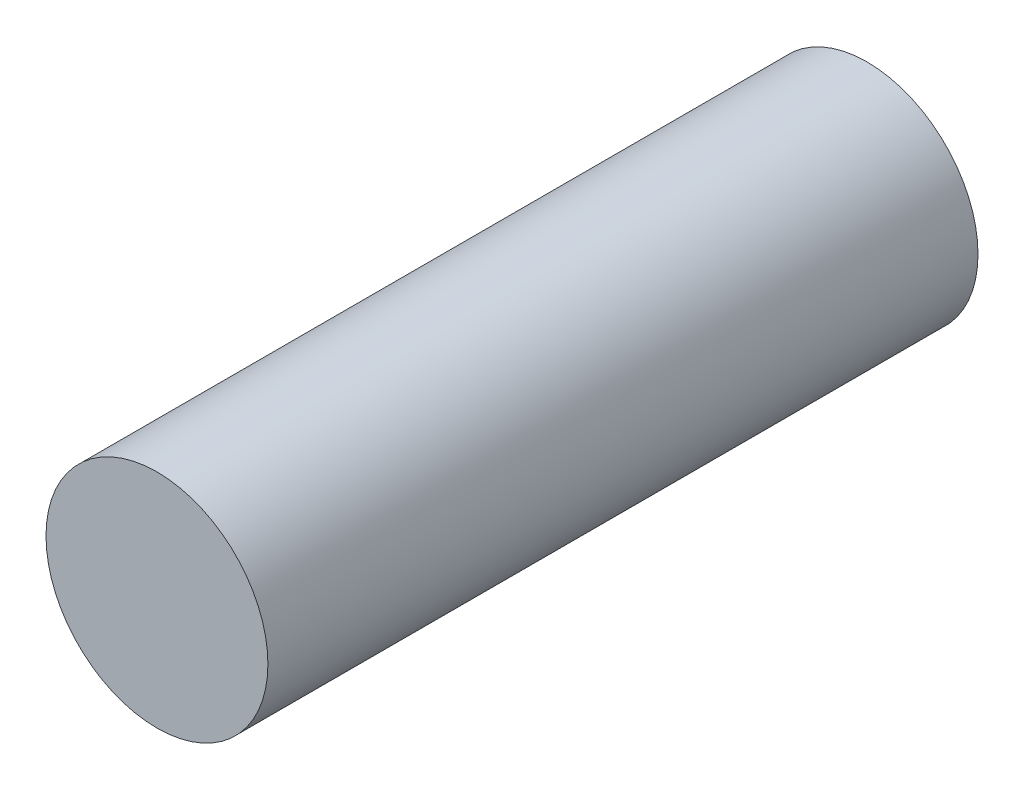
from build123d import *

# Parameters (mm, degrees)
SKETCH1_R           = 2.5
BOSS_EXTRUDE1_DEPTH = 8


with BuildPart() as part:
    # Sketch1 → Boss-Extrude1 (new, symmetric)
    with BuildSketch(Plane.XY):
        Circle(SKETCH1_R)
    extrude(amount=BOSS_EXTRUDE1_DEPTH, both=True)


solid = part.part
